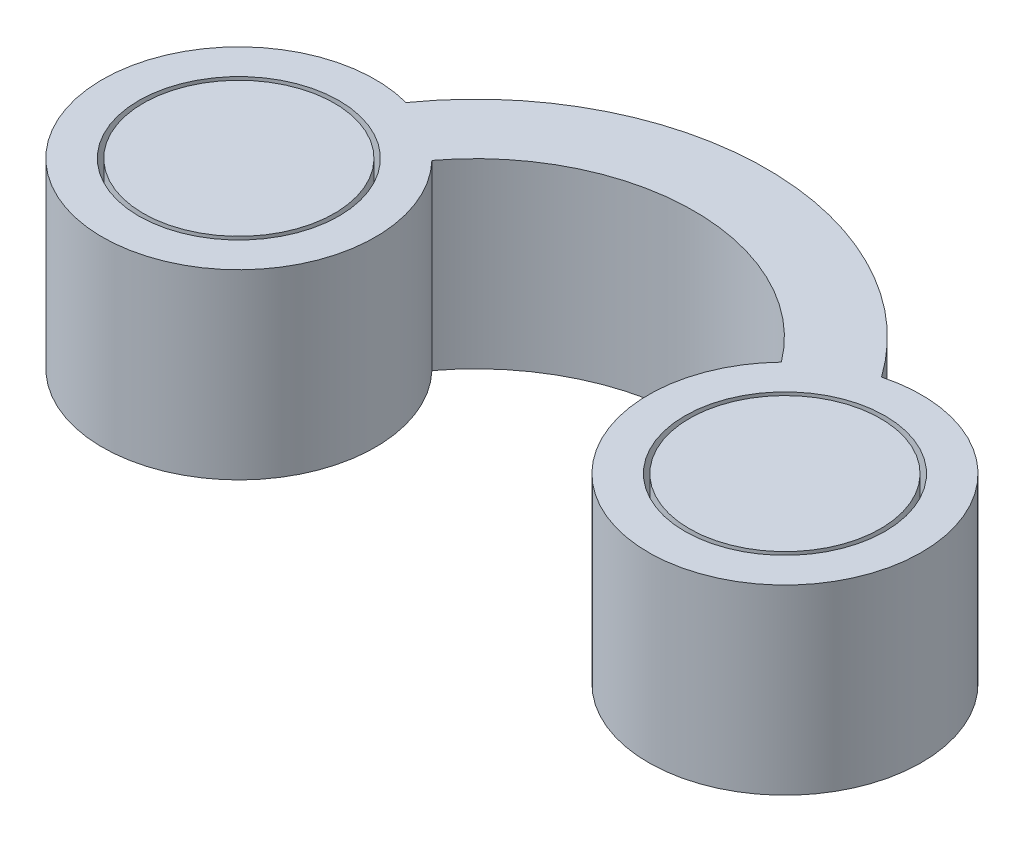
from build123d import *

# Parameters (mm, degrees)
SKETCH_1_R        = 0.75
SKETCH_1_R_2      = 0.55
EXTRUDE_1_DEPTH   = 0.5
SKETCH_2_R        = 0.525
EXTRUDE_3_DEPTH   = 0.5
EXTRUDE_3_2_DEPTH = 0.5


with BuildPart() as part:
    # 草图1 → 凸台-拉伸1 (new, symmetric)
    # profile 1 of 3: a face of its own
    with BuildSketch(Plane(origin=(0, 0, 0), x_dir=(1, 0, 0), z_dir=(0, 1, 0))):
        with Locations((1.5, 0)):
            Circle(SKETCH_1_R)
        with Locations(Location((1.5, 0, 0), (0, 0, 270))):
            Circle(SKETCH_1_R_2, mode=Mode.SUBTRACT)
    # profile 2 of 3: a face of its own
    with BuildSketch(Plane(origin=(0, 0, 0), x_dir=(1, 0, 0), z_dir=(0, 1, 0))):
        with Locations((-1.5, 0)):
            Circle(SKETCH_1_R)
        with Locations(Location((-1.5, 0, 0), (0, 0, 270))):
            Circle(SKETCH_1_R_2, mode=Mode.SUBTRACT)
    # profile 3 of 3: a face of its own
    with BuildSketch(Plane(origin=(0, 0, 0), x_dir=(1, 0, 0), z_dir=(0, 1, 0))):
        with BuildLine():
            ThreePointArc((-1.305906669, 0.724449984), (-1.118922567, 0.645972128), (-0.95979731, 0.520270174))
            ThreePointArc((-0.95979731, 0.520270174), (0, 1), (0.95979731, 0.520270174))
            ThreePointArc((0.95979731, 0.520270174), (1.118922567, 0.645972128), (1.305906669, 0.724449984))
            ThreePointArc((1.305906669, 0.724449984), (0, 1.4), (-1.305906669, 0.724449984))
        make_face()
    extrude(amount=EXTRUDE_1_DEPTH, both=True)


with BuildPart() as body_2:
    # 草图2 → 凸台-拉伸3 (new, symmetric)
    with BuildSketch(Plane(origin=(0, 0, 0), x_dir=(1, 0, 0), z_dir=(0, 1, 0))):
        with Locations(Location((-1.5, 0, 0), (0, 0, 270))):
            Circle(SKETCH_2_R)
    extrude(amount=EXTRUDE_3_DEPTH, both=True)


with BuildPart() as body_3:
    # 草图2 → Extrude 3 2 (new, symmetric)
    with BuildSketch(Plane(origin=(0, 0, 0), x_dir=(1, 0, 0), z_dir=(0, 1, 0))):
        with Locations(Location((1.5, 0, 0), (0, 0, 270))):
            Circle(SKETCH_2_R)
    extrude(amount=EXTRUDE_3_2_DEPTH, both=True)


solid = Compound([part.part, body_2.part, body_3.part])
